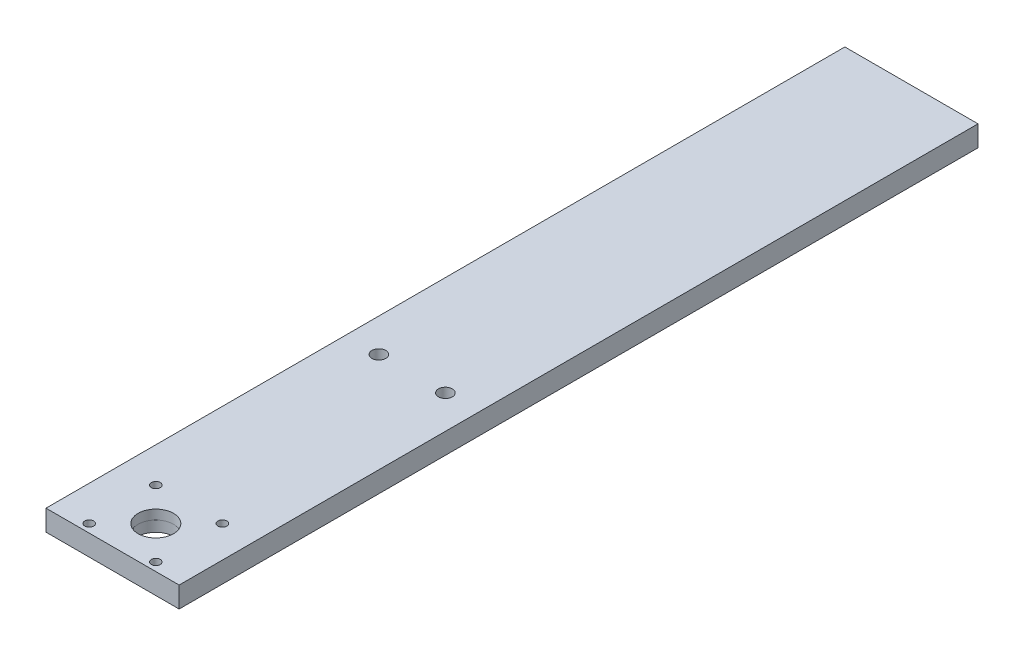
from build123d import *

# Parameters (mm, degrees)
BOSS_EXTRUDE1_DEPTH                             = 76.2
BOSS_EXTRUDE1_DEPTH_BACK                        = 76.2
SKETCH3_W                                       = 50.8
SKETCH3_H                                       = 7.9375
M12_CLEARANCE_HOLE2_D                           = 13.5
CSK_FOR_M5_FLAT_HEAD_MACHINE_SCREW1_D           = 5.3
CSK_FOR_M5_FLAT_HEAD_MACHINE_SCREW1_CSINK_D     = 10.4
CSK_FOR_M5_FLAT_HEAD_MACHINE_SCREW1_CSINK_ANGLE = 90
SKETCH26_W                                      = 50.8
SKETCH26_H                                      = 152.4
BOSS_EXTRUDE2_DEPTH                             = 7.9375
SKETCH27_R                                      = 7.112
CUT_EXTRUDE2_DEPTH                              = 4.318
M3_CLEARANCE_HOLE1_D                            = 3.4
M3_CLEARANCE_HOLE1_DEPTH                        = 15.24
M3_CLEARANCE_HOLE1_TIP                          = 1.021463052


with BuildPart() as part:
    # Sketch3 → Boss-Extrude1 (new, two sides: drawn at the far end of the back side and taken through both)
    with BuildSketch(Plane.XY.offset(-BOSS_EXTRUDE1_DEPTH_BACK)):
        Rectangle(SKETCH3_W, SKETCH3_H)
    extrude(amount=BOSS_EXTRUDE1_DEPTH + BOSS_EXTRUDE1_DEPTH_BACK)

    # M12 Clearance Hole2 (through all)
    with Locations(Plane(origin=(0, 3.96875, 0), x_dir=(1, 0, 0), z_dir=(0, 1, 0))):
        with Locations((0.625840615, -60.325)):
            Hole(M12_CLEARANCE_HOLE2_D / 2)

    # CSK for M5 Flat Head Machine Screw1 (through all)
    with Locations(Plane(origin=(0, -3.96875, 0), x_dir=(-1, 0, 0), z_dir=(0, -1, 0))):
        with Locations((-12.7, 38.1), (12.7, 38.1)):
            CounterSinkHole(CSK_FOR_M5_FLAT_HEAD_MACHINE_SCREW1_D / 2, CSK_FOR_M5_FLAT_HEAD_MACHINE_SCREW1_CSINK_D / 2, counter_sink_angle=CSK_FOR_M5_FLAT_HEAD_MACHINE_SCREW1_CSINK_ANGLE)

    # Sketch26 → Boss-Extrude2 (add)
    with BuildSketch(Plane(origin=(0, 3.96875, 0), x_dir=(1, 0, 0), z_dir=(0, 1, 0))):
        with Locations((0, 152.4)):
            Rectangle(SKETCH26_W, SKETCH26_H)
    extrude(amount=-BOSS_EXTRUDE2_DEPTH)

    # Sketch27 → Cut-Extrude2 (cut)
    with BuildSketch(Plane.XZ.offset(3.96875)):
        with Locations(Location((0.625840615, 60.325, 0), (0, 0, 270))):
            Circle(SKETCH27_R)
    extrude(amount=-CUT_EXTRUDE2_DEPTH, mode=Mode.SUBTRACT)

    # M3 Clearance Hole1
    with Locations(Plane(origin=(0, -3.96875, 0), x_dir=(-1, 0, 0), z_dir=(0, -1, 0))):
        with Locations((-13.325840615, -47.625), (-13.325840615, -73.025), (12.074159385, -73.025), (12.074159385, -47.625)):
            Hole(M3_CLEARANCE_HOLE1_D / 2, depth=M3_CLEARANCE_HOLE1_DEPTH)
            with Locations((0, 0, -(M3_CLEARANCE_HOLE1_DEPTH + M3_CLEARANCE_HOLE1_TIP / 2))):  # 118° drill point
                Cone(0, M3_CLEARANCE_HOLE1_D / 2, M3_CLEARANCE_HOLE1_TIP, mode=Mode.SUBTRACT)


solid = part.part
